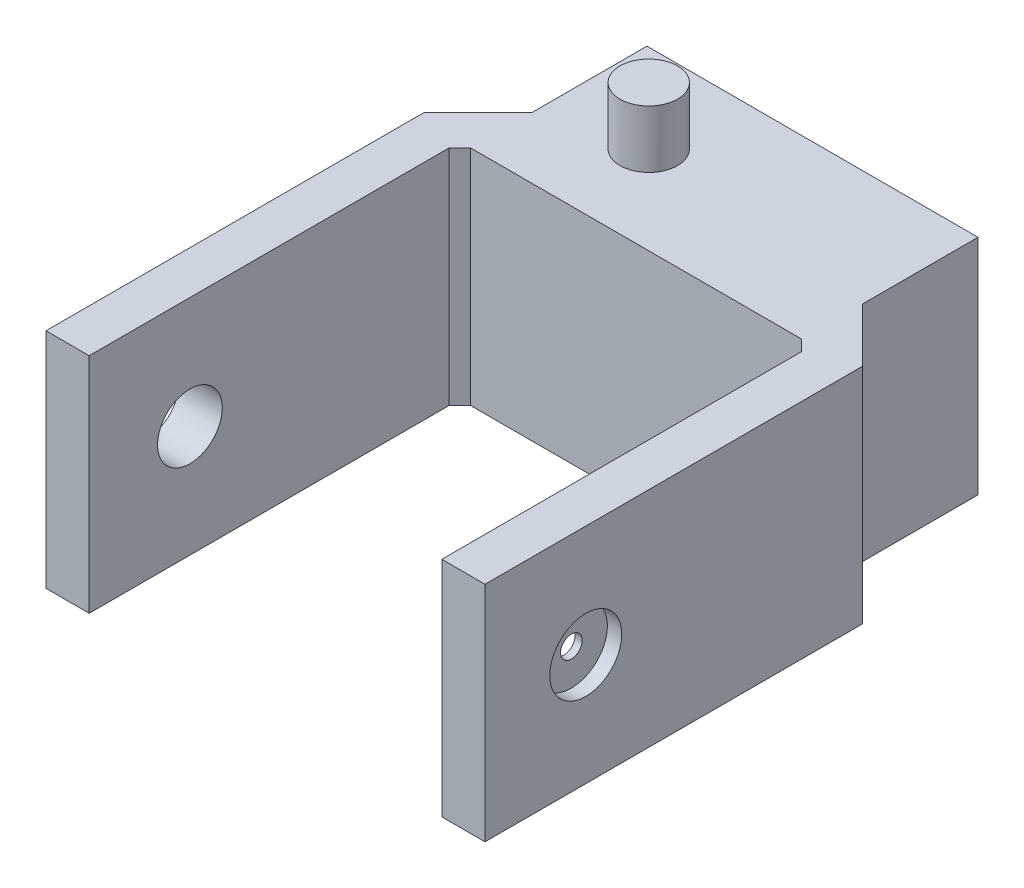
from build123d import *

# Parameters (mm, degrees)
SKETCH1_W               = 46
SKETCH1_H               = 24.5
BODY_DEPTH              = 31
SKETCH3_W               = 42
SKETCH3_H               = 20.5
SERVO_HOLE_DEPTH        = 29
SKETCH6_R               = 4
BOSS_EXTRUDE3_DEPTH     = 8
BOSS_EXTRUDE4_DEPTH     = 31
CUT_EXTRUDE3_DEPTH      = 2
CUT_EXTRUDE3_DEPTH_BACK = 29
CUT_EXTRUDE4_DEPTH      = 3
CUT_EXTRUDE5_DEPTH      = 93.790422458
CUT_EXTRUDE5_DEPTH_BACK = 93.790422458
SKETCH11_R              = 1.5
SKETCH12_R              = 4.5
CUT_EXTRUDE6_DEPTH      = 6
SKETCH13_R              = 5
CUT_EXTRUDE7_DEPTH      = 2


with BuildPart() as part:
    # Sketch1 → Body (new body)
    with BuildSketch(Plane(origin=(0, 0, 0), x_dir=(1, 0, 0), z_dir=(0, 1, 0))):
        Rectangle(SKETCH1_W, SKETCH1_H)
    extrude(amount=BODY_DEPTH)

    # Sketch3 → Servo Hole (cut)
    with BuildSketch(Plane(origin=(0, 0, 0), x_dir=(1, 0, 0), z_dir=(0, 1, 0))):
        Rectangle(SKETCH3_W, SKETCH3_H)
    extrude(amount=SERVO_HOLE_DEPTH, mode=Mode.SUBTRACT)

    # Sketch6 → Boss-Extrude3 (add)
    with BuildSketch(Plane(origin=(0, 31, 0), x_dir=(1, 0, 0), z_dir=(0, 1, 0))):
        with Locations(Location((10.5, 0, 0), (0, 0, 90))):
            Circle(SKETCH6_R)
    extrude(amount=BOSS_EXTRUDE3_DEPTH)

    # Sketch8 → Boss-Extrude4 (add)
    with BuildSketch(Plane.XZ):
        Polygon((-23, 12.25), (-24.5, 13.75), (-24.5, 63.75), (-30.5, 63.75), (-30.5, 11.264718626), (-23, 3.764718626), align=None)
        Polygon((24.5, 63.75), (24.5, 13.75), (23, 12.25), (23, 3.764718626), (30.5, 11.264718626), (30.5, 63.75), align=None)
    extrude(amount=-BOSS_EXTRUDE4_DEPTH)

    # Sketch5 → Cut-Extrude3 (cut, two sides: drawn at the far end of the back side and taken through both)
    with BuildSketch(Plane.ZY.offset(-23).offset(-CUT_EXTRUDE3_DEPTH_BACK)):
        Polygon((-6, 27), (6, 27), (6, 22), (4.25, 22), (4.25, 2), (-4.25, 2), (-4.25, 22), (-6, 22), align=None)
    extrude(amount=CUT_EXTRUDE3_DEPTH + CUT_EXTRUDE3_DEPTH_BACK, mode=Mode.SUBTRACT)

    # Sketch10 → Cut-Extrude4 (cut)
    with BuildSketch(Plane(origin=(-24.5, 0, 0), x_dir=(0, 0, -1), z_dir=(1, 0, 0))):
        with BuildLine():
            Line((-32.75, 12.5), (-49.75, 9))
            ThreePointArc((-49.75, 9), (-56.25, 15.5), (-49.75, 22))
            Line((-49.75, 22), (-32.75, 18.5))
            ThreePointArc((-32.75, 18.5), (-29.75, 15.5), (-32.75, 12.5))
        make_face()
    extrude(amount=-CUT_EXTRUDE4_DEPTH, mode=Mode.SUBTRACT)

    # Sketch11 → Cut-Extrude5 (cut, two sides: drawn at the far end of the back side and taken through both)
    with BuildSketch(Plane(origin=(-24.5, 0, 0), x_dir=(0, 0, -1), z_dir=(1, 0, 0)).offset(-CUT_EXTRUDE5_DEPTH_BACK)):
        with Locations((-49.75, 15.5)):
            Circle(SKETCH11_R)
    extrude(amount=CUT_EXTRUDE5_DEPTH + CUT_EXTRUDE5_DEPTH_BACK, mode=Mode.SUBTRACT)

    # Sketch12 → Cut-Extrude6 (cut)
    with BuildSketch(Plane(origin=(30.5, 0, 0), x_dir=(0, 0, -1), z_dir=(1, 0, 0))):
        with Locations((-49.75, 15.5)):
            Circle(SKETCH12_R)
    extrude(amount=-CUT_EXTRUDE6_DEPTH, mode=Mode.SUBTRACT)

    # Sketch13 → Cut-Extrude7 (cut)
    with BuildSketch(Plane.ZY.offset(30.5)):
        with Locations((49.75, 15.5)):
            Circle(SKETCH13_R)
    extrude(amount=-CUT_EXTRUDE7_DEPTH, mode=Mode.SUBTRACT)


with BuildPart() as body_2:
    # Mirror2: mirrored copy
    add(part.part.mirror(Plane(origin=(-30.5, 91.452328173, 11.264718626), x_dir=(0, 0, 1), z_dir=(-1, 0, 0))))


solid = body_2.part
